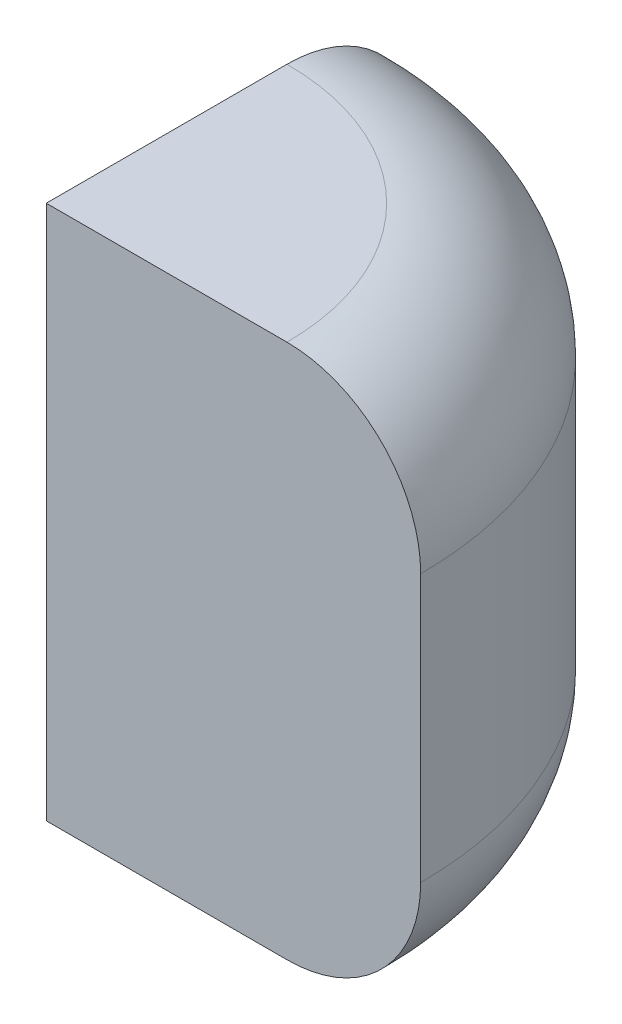
from build123d import *

# Parameters (mm, degrees)
REVOLVE1_ANGLE = 90


with BuildPart() as part:
    # Sketch1 → Revolve1 (revolve)
    with BuildSketch(Plane.XY):
        with BuildLine():
            Line((0, 0), (57.15, 0))
            ThreePointArc((57.15, 0), (79.600640303, 9.299359697), (88.9, 31.75))
            Line((88.9, 31.75), (88.9, 95.25))
            ThreePointArc((88.9, 95.25), (79.600640303, 117.700640303), (57.15, 127))
            Line((57.15, 127), (0, 127))
            Line((0, 127), (0, 0))
        make_face()
    revolve(axis=Axis((0, 0, 0), (0, 1, 0)), revolution_arc=REVOLVE1_ANGLE)


solid = part.part
